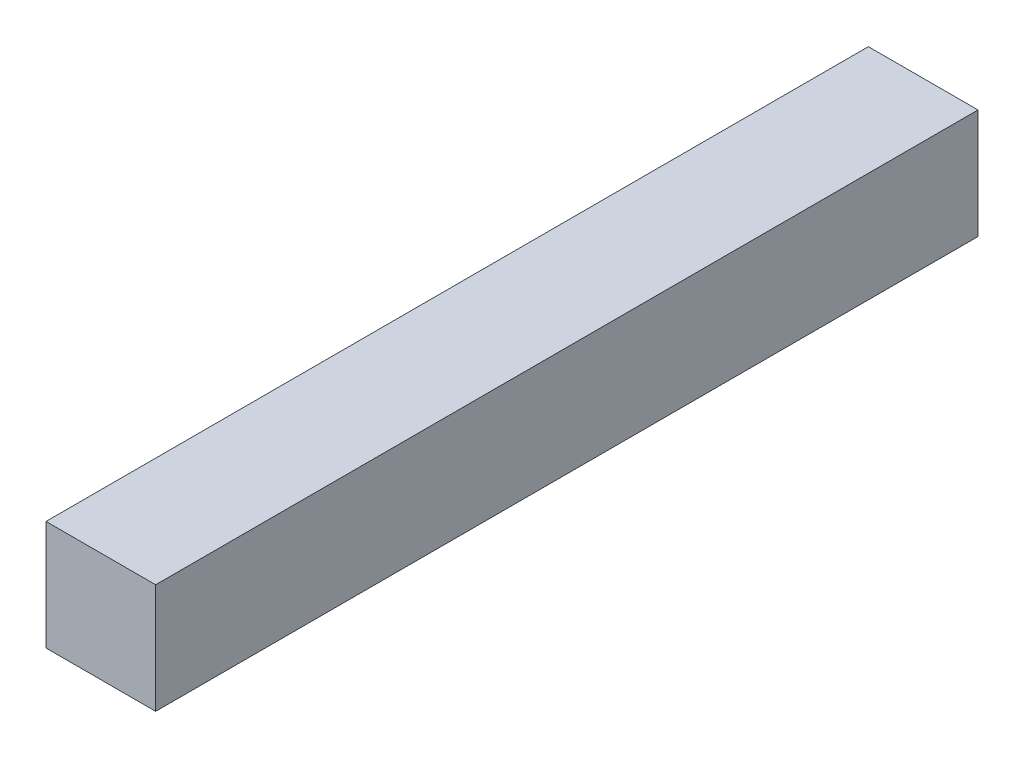
from build123d import *

# Parameters (mm, degrees)
CROQUIS1_W              = 20
CROQUIS1_H              = 20
SALIENTE_EXTRUIR1_DEPTH = 75
CROQUIS2_R              = 2.5
CORTAR_EXTRUIR2_DEPTH   = 10


with BuildPart() as part:
    # Croquis1 → Saliente-Extruir1 (new, symmetric)
    with BuildSketch(Plane.XY):
        Rectangle(CROQUIS1_W, CROQUIS1_H)
    extrude(amount=SALIENTE_EXTRUIR1_DEPTH, both=True)

    # Croquis2 → Cortar-Extruir2 (cut)
    with BuildSketch(Plane(origin=(0, 0, -75), x_dir=(-1, 0, 0), z_dir=(0, 0, -1))):
        Circle(CROQUIS2_R)
    extrude(amount=-CORTAR_EXTRUIR2_DEPTH, mode=Mode.SUBTRACT)


solid = part.part
